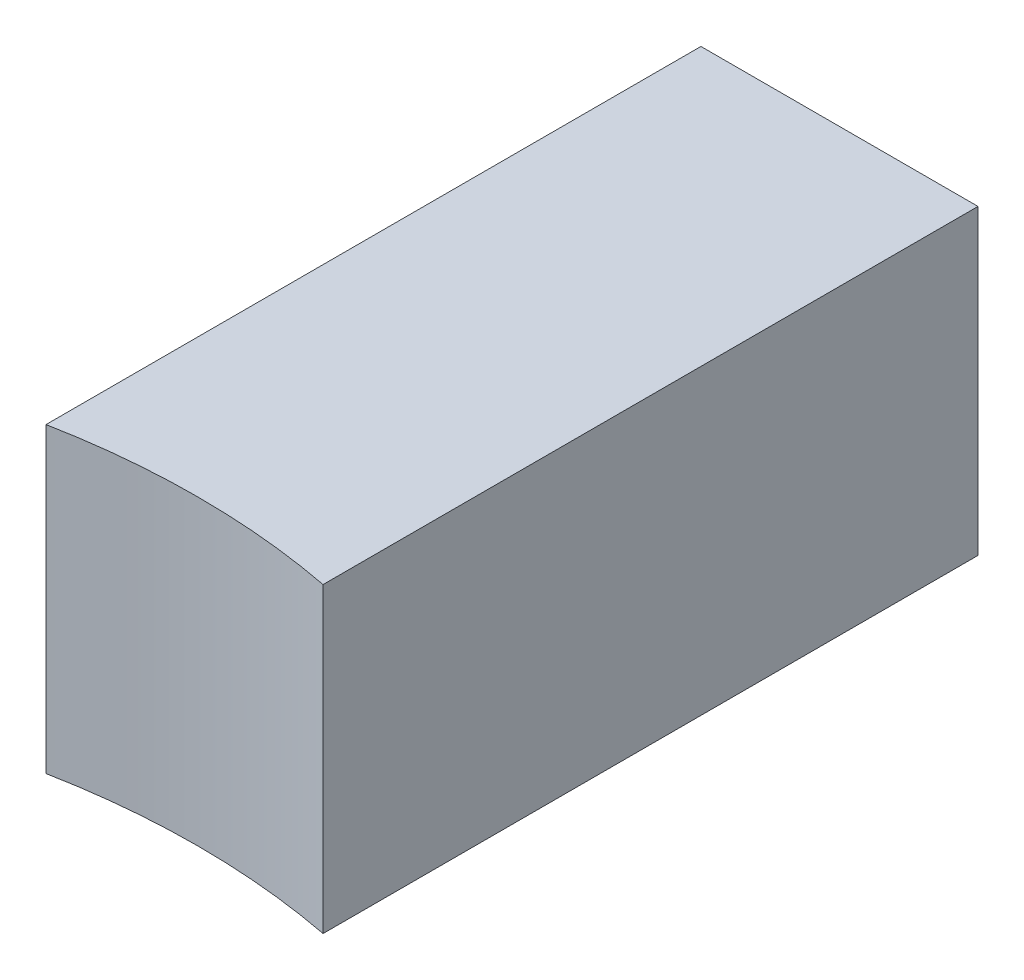
from build123d import *

# Parameters (mm, degrees)
BOSS_EXTRU_1_DEPTH = 6


with BuildPart() as part:
    # Esquisse1 → Boss.-Extru.1 (new body)
    with BuildSketch(Plane(origin=(0, 0, 0), x_dir=(1, 0, 0), z_dir=(0, 1, 0))):
        with BuildLine():
            Line((-2.75, 27.236836025), (2.75, 27.236836025))
            Line((2.75, 27.236836025), (2.75, 14.236836025))
            ThreePointArc((2.75, 14.236836025), (0, 14.5), (-2.75, 14.236836025))
            Line((-2.75, 14.236836025), (-2.75, 27.236836025))
        make_face()
    extrude(amount=-BOSS_EXTRU_1_DEPTH)


solid = part.part
